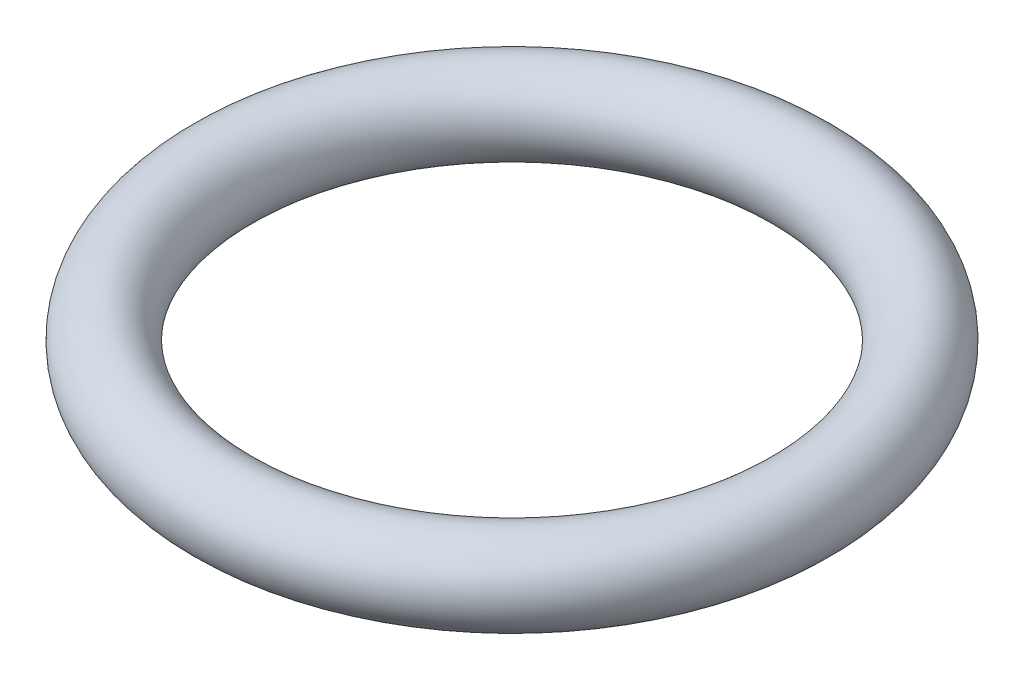
from build123d import *

# Parameters (mm, degrees)
SKETCH1_R = 0.762


with BuildPart() as part:
    # Sketch1 → Revolve1 (revolve)
    with BuildSketch(Plane.XY):
        with Locations((5.3848, 0)):
            Circle(SKETCH1_R)
    revolve(axis=Axis((0, 0, 0), (0, -1, 0)))


solid = part.part
